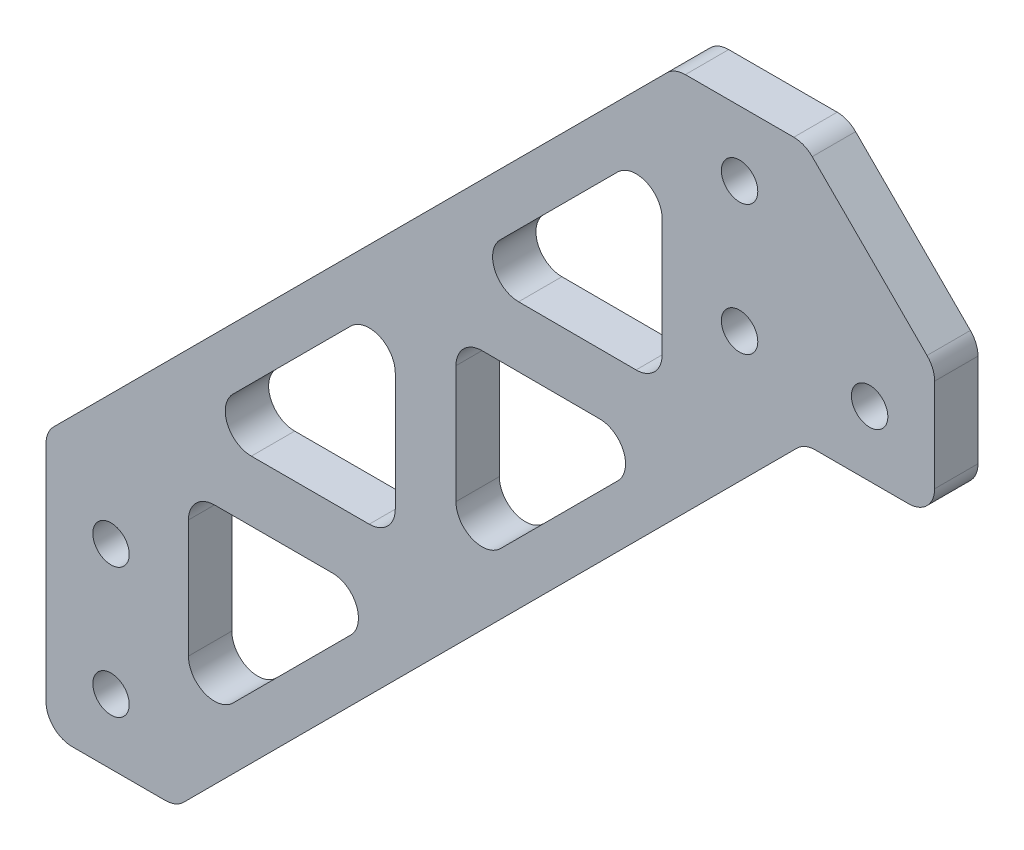
from build123d import *

# Parameters (mm, degrees)
SKETCH_1_R          = 2.1
SKETCH_1_W          = 15
SKETCH_1_H          = 15
EXTRUDE_1_DEPTH     = 5
CUT_EXTRUDE_1_DEPTH = 125.298028947
FILLET_1_R          = 3.005
FILLET_2_R          = 3.005


with BuildPart() as part:
    # ｽｹｯﾁ1 → ﾎﾞｽ - 押し出し1 (new body)
    # profile 1 of 3: a face of its own
    with BuildSketch(Plane.XY):
        Polygon((7.5, -7.5), (7.5, -22.5), (22.5, -7.5), (80, 50), (95, 50), (95, 65), (80, 80), (65, 80), (-7.5, 7.5), (7.5, 7.5), align=None)
        with Locations((72.5, 57.5)):
            Circle(SKETCH_1_R, mode=Mode.SUBTRACT)
        with Locations((87.5, 57.5)):
            Circle(SKETCH_1_R, mode=Mode.SUBTRACT)
        with Locations((72.5, 72.5)):
            Circle(SKETCH_1_R, mode=Mode.SUBTRACT)
    # profile 2 of 3: a face of its own
    with BuildSketch(Plane.XY):
        with Locations((0, -15)):
            Rectangle(SKETCH_1_W, SKETCH_1_H)
        with Locations((0, -15)):
            Circle(SKETCH_1_R, mode=Mode.SUBTRACT)
    # profile 3 of 3: a face of its own
    with BuildSketch(Plane.XY):
        Rectangle(SKETCH_1_W, SKETCH_1_H)
        Circle(SKETCH_1_R, mode=Mode.SUBTRACT)
    extrude(amount=EXTRUDE_1_DEPTH)

    # ｽｹｯﾁ2 → ｶｯﾄ - 押し出し1 (cut, through all)
    with BuildSketch(Plane.XY.offset(5)):
        Polygon((8.928932188, -14), (32.786796564, 9.857864376), (8.928932188, 9.857864376), align=None)
        Polygon((32.786796564, 16.857864376), (32.786796564, 40.715728753), (8.928932188, 16.857864376), align=None)
        Polygon((39.786796564, 16.857864376), (63.579405008, 40.65047282), (39.786796564, 40.707351623), align=None)
        Polygon((63.571067812, 47.650512753), (63.571067812, 71.5), (39.778459368, 47.707391556), align=None)
    extrude(amount=-CUT_EXTRUDE_1_DEPTH, mode=Mode.SUBTRACT)

    # ﾌｨﾚｯﾄ1
    fillet_1_edges = [part.edges().sort_by_distance(p)[0] for p in [
        (8.928932188, 9.857864376, 2.5),
        (32.786796564, 9.857864376, 2.5),
        (8.928932188, -14, 2.5),
        (32.786796564, 16.857864376, 2.5),
        (8.928932188, 16.857864376, 2.5),
        (32.786796564, 40.715728753, 2.5),
        (39.786796564, 40.707351623, 2.5),
        (63.579405008, 40.65047282, 2.5),
        (39.786796564, 16.857864376, 2.5),
        (63.571067812, 71.5, 2.5),
        (63.571067812, 47.650512753, 2.5),
        (39.778459368, 47.707391556, 2.5),
    ]]
    fillet(fillet_1_edges, radius=FILLET_1_R)

    # ﾌｨﾚｯﾄ2
    fillet_2_edges = [part.edges().sort_by_distance(p)[0] for p in [
        (-7.5, 7.5, 2.5),
        (65, 80, 2.5),
        (80, 80, 2.5),
        (95, 65, 2.5),
        (95, 50, 2.5),
        (80, 50, 2.5),
        (7.5, -22.5, 2.5),
        (-7.5, -22.5, 2.5),
    ]]
    fillet(fillet_2_edges, radius=FILLET_2_R)


solid = part.part
